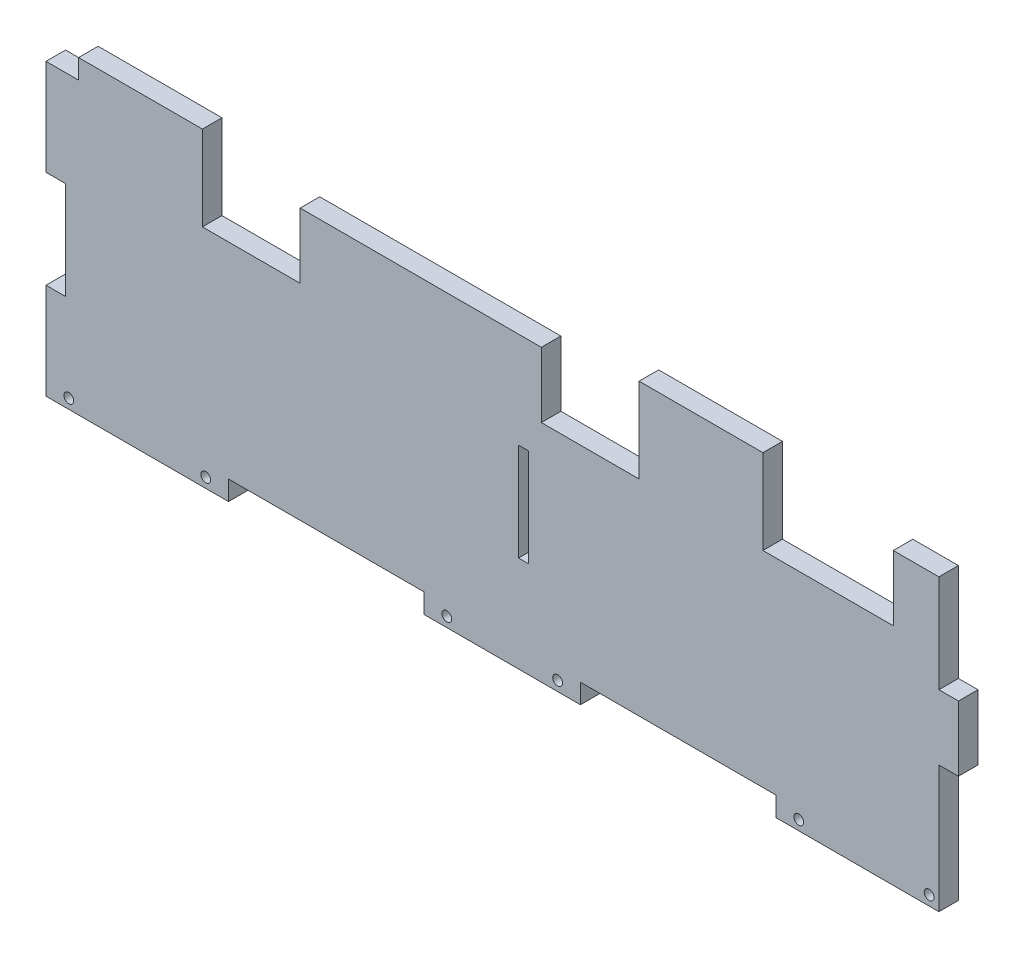
from build123d import *

# Parameters (mm, degrees)
ESQUISSE2_W             = 330
ESQUISSE2_H             = 95
BOSS_EXTRU_1_DEPTH      = 6
ESQUISSE3_W             = 6
ESQUISSE3_H             = 39
ESQUISSE3_W_2           = 60
ESQUISSE3_H_2           = 6
ESQUISSE3_H_3           = 30
ESQUISSE3_W_3           = 3
ENL_V_MAT_EXTRU_1_DEPTH = 344.45450936
ESQUISSE4_W             = 56.799161249
ESQUISSE4_H             = 89
ENL_V_MAT_EXTRU_2_DEPTH = 344.45450936
ESQUISSE5_R             = 1.5
ENL_V_MAT_EXTRU_3_DEPTH = 296.738059776
ESQUISSE6_R             = 2.995
ENL_V_MAT_EXTRU_5_DEPTH = 3


with BuildPart() as part:
    # Esquisse2 → Boss.-Extru.1 (new body)
    with BuildSketch(Plane.XY):
        with Locations((-165, 47.5)):
            Rectangle(ESQUISSE2_W, ESQUISSE2_H)
    extrude(amount=BOSS_EXTRU_1_DEPTH)

    # Esquisse3 → Enlèv. mat.-Extru.1 (cut, through all)
    with BuildSketch(Plane.XY.offset(6)):
        Polygon((-60, 95), (0, 95), (0, 59), (-6, 59), (-6, 89), (-20, 89), (-20, 69), (-60, 69), align=None)
        with Locations((-3, 19.5)):
            Rectangle(ESQUISSE3_W, ESQUISSE3_H)
        Polygon((-330, 95), (-270, 95), (-270, 89), (-324, 89), (-324, 59), (-330, 59), align=None)
        with Locations((-86, 3)):
            Rectangle(ESQUISSE3_W_2, ESQUISSE3_H_2)
        with Locations((-194, 3)):
            Rectangle(ESQUISSE3_W_2, ESQUISSE3_H_2)
        with Locations((-277, 44.5)):
            Rectangle(ESQUISSE3_W, ESQUISSE3_H_3)
        with Locations((-327, 19.5)):
            Rectangle(ESQUISSE3_W, ESQUISSE3_H)
        Polygon((-98, 95), (-98, 69), (-128, 69), (-128, 89), (-202, 89), (-202, 69), (-232, 69), (-232, 95), align=None)
        with Locations((-133.5, 44.5)):
            Rectangle(ESQUISSE3_W_3, ESQUISSE3_H_3)
    extrude(amount=-ENL_V_MAT_EXTRU_1_DEPTH, mode=Mode.SUBTRACT)

    # Esquisse4 → Enlèv. mat.-Extru.2 (cut, through all)
    with BuildSketch(Plane.XY.offset(6)):
        with Locations((-308.399580625, 44.5)):
            Rectangle(ESQUISSE4_W, ESQUISSE4_H)
    extrude(amount=-ENL_V_MAT_EXTRU_2_DEPTH, mode=Mode.SUBTRACT)

    # Esquisse5 → Enlèv. mat.-Extru.3 (cut, through all)
    with BuildSketch(Plane(origin=(0, 0, 0), x_dir=(-1, 0, 0), z_dir=(0, 0, -1))):
        with Locations((9, 3)):
            Circle(ESQUISSE5_R)
        with Locations((49, 3)):
            Circle(ESQUISSE5_R)
        with Locations((123, 3)):
            Circle(ESQUISSE5_R)
        with Locations((157, 3)):
            Circle(ESQUISSE5_R)
        with Locations((231, 3)):
            Circle(ESQUISSE5_R)
        with Locations((273, 3)):
            Circle(ESQUISSE5_R)
    extrude(amount=-ENL_V_MAT_EXTRU_3_DEPTH, mode=Mode.SUBTRACT)

    # Esquisse6 → Enlèv. mat.-Extru.5 (cut)
    with BuildSketch(Plane(origin=(0, 0, 0), x_dir=(-1, 0, 0), z_dir=(0, 0, -1))):
        with Locations((9, 3)):
            Circle(ESQUISSE6_R)
        with Locations((49, 3)):
            Circle(ESQUISSE6_R)
        with Locations((123, 3)):
            Circle(ESQUISSE6_R)
        with Locations((157, 3)):
            Circle(ESQUISSE6_R)
        with Locations((273, 3)):
            Circle(ESQUISSE6_R)
        with Locations((231, 3)):
            Circle(ESQUISSE6_R)
    extrude(amount=-ENL_V_MAT_EXTRU_5_DEPTH, mode=Mode.SUBTRACT)


solid = part.part
